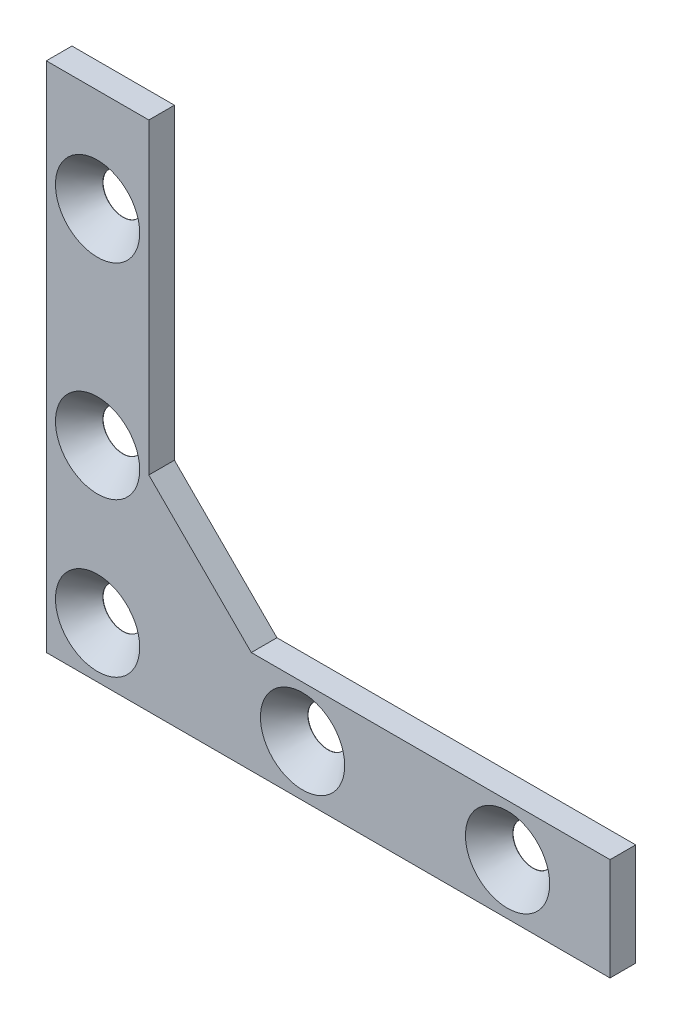
from build123d import *

# Parameters (mm, degrees)
BOSS_EXTRUDE1_DEPTH             = 3.175
F_10_CLEARANCE_HOLE1_AT_2_COUNT = 2
F_10_CLEARANCE_HOLE1_AT_2_PITCH = 19.05
F_10_CLEARANCE_HOLE1_AT_3_COUNT = 2
F_10_CLEARANCE_HOLE1_AT_3_PITCH = 44.45
F_10_CLEARANCE_HOLE1_AT_4_COUNT = 2
F_10_CLEARANCE_HOLE1_AT_4_PITCH = 25.4
F_10_CLEARANCE_HOLE1_AT_5_COUNT = 2
F_10_CLEARANCE_HOLE1_AT_5_PITCH = 50.8


with BuildPart() as part:
    # Sketch1 → Boss-Extrude1 (new body)
    with BuildSketch(Plane.XY):
        Polygon((-260.753367516, 0), (-273.453367516, 0), (-273.453367516, 63.5), (-260.753367516, 63.5), (-260.753367516, 25.4), (-248.053367516, 12.7), (-203.603367516, 12.7), (-203.603367516, 0), align=None)
    extrude(amount=BOSS_EXTRUDE1_DEPTH)

    # Sketch4 → #10 Clearance Hole1 (revolve, cut)
    with BuildSketch(Plane(origin=(-267.103367516, 6.35, 3.175), x_dir=(0, -1, 0), z_dir=(1, 0, 0))):
        Polygon((0, 0), (0, 3.175), (2.4892, 3.175), (2.4892, 3.141080936), (5.2197, 0), align=None)
    f_10_clearance_hole1 = revolve(axis=Axis((-267.103367516, 6.35, 9.525), (0, 0, -1)), mode=Mode.SUBTRACT)

    # #10 Clearance Hole1 at 2: #10 Clearance Hole1 ×2
    with Locations(*[(0, i * F_10_CLEARANCE_HOLE1_AT_2_PITCH, 0) for i in range(1, F_10_CLEARANCE_HOLE1_AT_2_COUNT)]):
        add(f_10_clearance_hole1, mode=Mode.SUBTRACT)

    # #10 Clearance Hole1 at 3: #10 Clearance Hole1 ×2
    with Locations(*[(0, i * F_10_CLEARANCE_HOLE1_AT_3_PITCH, 0) for i in range(1, F_10_CLEARANCE_HOLE1_AT_3_COUNT)]):
        add(f_10_clearance_hole1, mode=Mode.SUBTRACT)

    # #10 Clearance Hole1 at 4: #10 Clearance Hole1 ×2
    with Locations(*[(i * F_10_CLEARANCE_HOLE1_AT_4_PITCH, 0, 0) for i in range(1, F_10_CLEARANCE_HOLE1_AT_4_COUNT)]):
        add(f_10_clearance_hole1, mode=Mode.SUBTRACT)

    # #10 Clearance Hole1 at 5: #10 Clearance Hole1 ×2
    with Locations(*[(i * F_10_CLEARANCE_HOLE1_AT_5_PITCH, 0, 0) for i in range(1, F_10_CLEARANCE_HOLE1_AT_5_COUNT)]):
        add(f_10_clearance_hole1, mode=Mode.SUBTRACT)


solid = part.part
